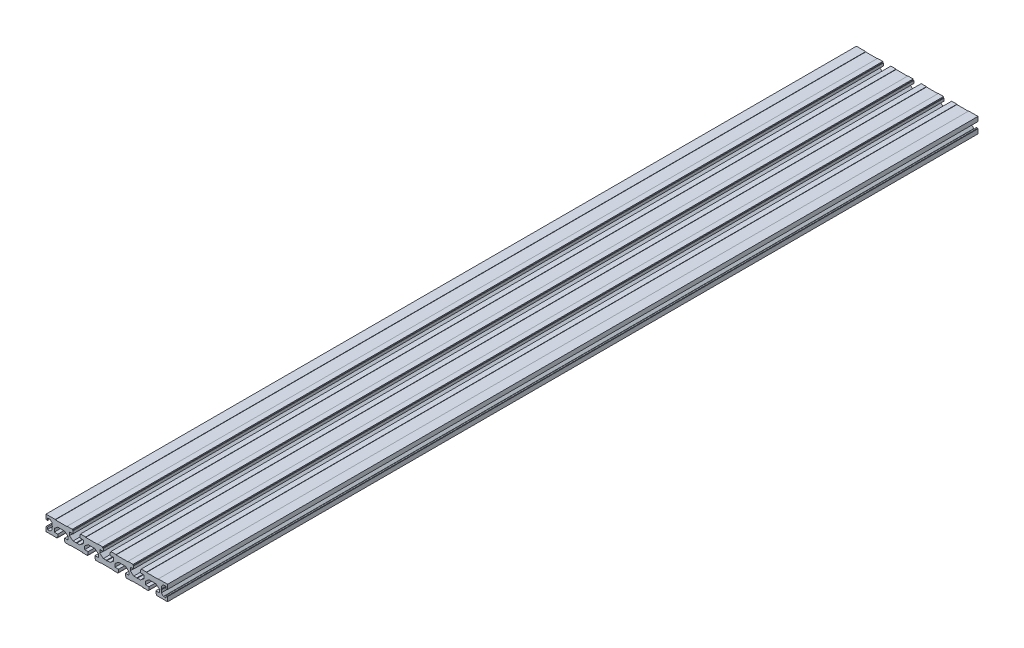
from build123d import *

# Parameters (mm, degrees)
BOSS_EXTRUDE1_DEPTH = 1200


with BuildPart() as part:
    # Model → Boss-Extrude1 (new body)
    with BuildSketch(Plane.XY):
        Polygon((-16.5, -11.25), (-16.5, -9.75), (-17.4, -9.75), (-17.4, -5.75), (-12.25, -5.75), (-12.25, -0.979898987), (-17.5, 3.25), (-22, 3.25), (-22.5, 3.75), (-23, 3.25), (-27.5, 3.25), (-32.75, -0.979898987), (-32.75, -5.75), (-27.6, -5.75), (-27.6, -9.75), (-28.5, -9.75), (-28.5, -11.25), (-36.25, -11.25), (-36.25, -10.75), (-53.75, -10.75), (-53.75, -11.25), (-61.5, -11.25), (-61.5, -9.75), (-62.4, -9.75), (-62.4, -5.75), (-57.25, -5.75), (-57.25, -0.979898987), (-62.5, 3.25), (-67, 3.25), (-67.5, 3.75), (-68, 3.25), (-72.5, 3.25), (-77.75, -0.979898987), (-77.75, -5.75), (-72.6, -5.75), (-72.6, -9.75), (-73.5, -9.75), (-73.5, -11.25), (-90, -11.25), (-90, -4.6), (-89.5, -4.1), (-87.8, -4.1), (-87.8, -7.456), (-83.870213562, -7.456), (-80.75, -4.335786438), (-80.75, -0.5), (-80.25, 0), (-80.75, 0.5), (-80.75, 4.335786438), (-83.870213562, 7.456), (-87.8, 7.456), (-87.8, 4.1), (-89.5, 4.1), (-90, 4.6), (-90, 11.25), (-76.25, 11.25), (-76.25, 10.75), (-58.75, 10.75), (-58.75, 11.25), (-51, 11.25), (-51, 9.75), (-50.1, 9.75), (-50.1, 5.75), (-55.25, 5.75), (-55.25, 0.979898987), (-50, -3.25), (-45.5, -3.25), (-45, -3.75), (-44.5, -3.25), (-40, -3.25), (-34.75, 0.979898987), (-34.75, 5.75), (-39.9, 5.75), (-39.9, 9.75), (-39, 9.75), (-39, 11.25), (-31.25, 11.25), (-31.25, 10.75), (-13.75, 10.75), (-13.75, 11.25), (-6, 11.25), (-6, 9.75), (-5.1, 9.75), (-5.1, 5.75), (-10.25, 5.75), (-10.25, 0.979898987), (-5, -3.25), (-0.5, -3.25), (0, -3.75), (0.5, -3.25), (5, -3.25), (10.25, 0.979898987), (10.25, 5.75), (5.1, 5.75), (5.1, 9.75), (6, 9.75), (6, 11.25), (13.75, 11.25), (13.75, 10.75), (31.25, 10.75), (31.25, 11.25), (39, 11.25), (39, 9.75), (39.9, 9.75), (39.9, 5.75), (34.75, 5.75), (34.75, 0.979898987), (40, -3.25), (44.5, -3.25), (45, -3.75), (45.5, -3.25), (50, -3.25), (55.25, 0.979898987), (55.25, 5.75), (50.1, 5.75), (50.1, 9.75), (51, 9.75), (51, 11.25), (58.75, 11.25), (58.75, 10.75), (76.25, 10.75), (76.25, 11.25), (90, 11.25), (90, 4.6), (89.5, 4.1), (87.8, 4.1), (87.8, 7.456), (83.870213562, 7.456), (80.75, 4.335786438), (80.75, 0.5), (80.25, 0), (80.75, -0.5), (80.75, -4.335786438), (83.870213562, -7.456), (87.8, -7.456), (87.8, -4.1), (89.5, -4.1), (90, -4.6), (90, -11.25), (73.5, -11.25), (73.5, -9.75), (72.6, -9.75), (72.6, -5.75), (77.75, -5.75), (77.75, -0.979898987), (72.5, 3.25), (68, 3.25), (67.5, 3.75), (67, 3.25), (62.5, 3.25), (57.25, -0.979898987), (57.25, -5.75), (62.4, -5.75), (62.4, -9.75), (61.5, -9.75), (61.5, -11.25), (53.75, -11.25), (53.75, -10.75), (36.25, -10.75), (36.25, -11.25), (28.5, -11.25), (28.5, -9.75), (27.6, -9.75), (27.6, -5.75), (32.75, -5.75), (32.75, -0.979898987), (27.5, 3.25), (23, 3.25), (22.5, 3.75), (22, 3.25), (17.5, 3.25), (12.25, -0.979898987), (12.25, -5.75), (17.4, -5.75), (17.4, -9.75), (16.5, -9.75), (16.5, -11.25), (8.75, -11.25), (8.75, -10.75), (-8.75, -10.75), (-8.75, -11.25), align=None)
    extrude(amount=BOSS_EXTRUDE1_DEPTH)


solid = part.part
